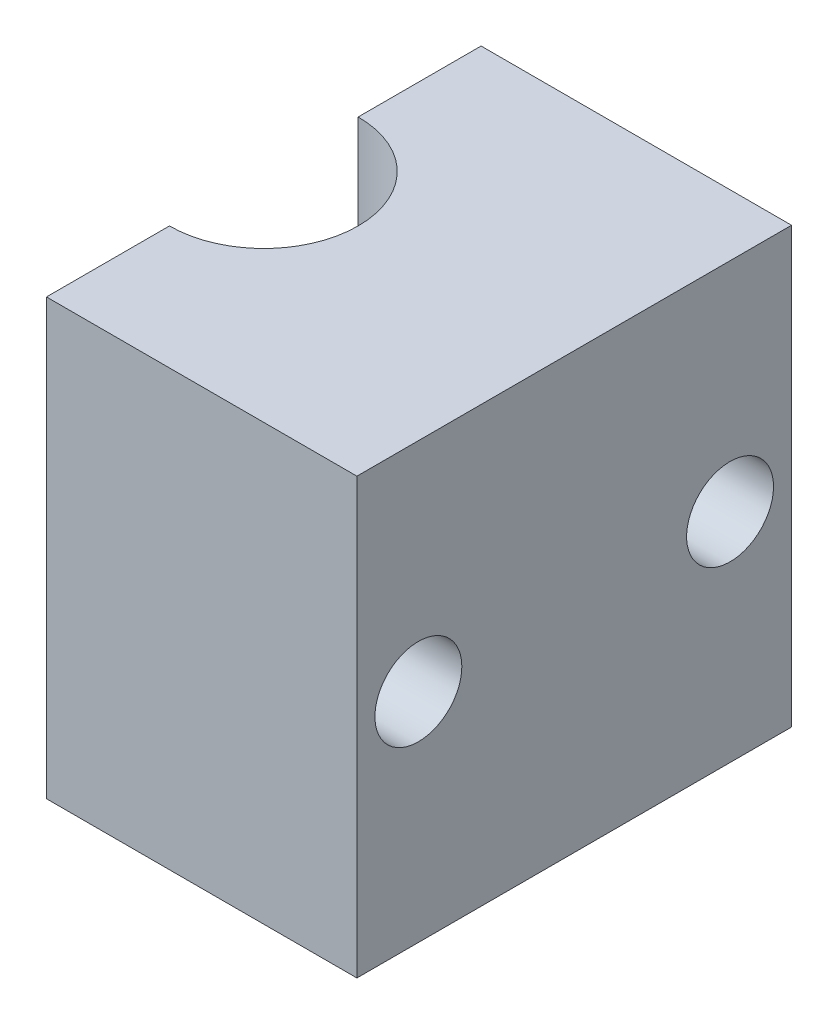
from build123d import *

# Parameters (mm, degrees)
BOSS_EXTRUDE1_DEPTH = 35
SKETCH3_R           = 6.3
CUT_EXTRUDE1_DEPTH  = 20
SKETCH4_R           = 1.5
CUT_EXTRUDE2_DEPTH  = 47.435439128
SKETCH5_R           = 3.5
CUT_EXTRUDE3_DEPTH  = 5


with BuildPart() as part:
    # Sketch1 → Boss-Extrude1 (new body)
    with BuildSketch(Plane(origin=(0, 0, 0), x_dir=(1, 0, 0), z_dir=(0, 1, 0))):
        with BuildLine():
            Line((-32.48, -7.6), (-32.48, -17.5))
            Line((-32.48, -17.5), (-7.48, -17.5))
            Line((-7.48, -17.5), (-7.48, 17.5))
            Line((-7.48, 17.5), (-32.48, 17.5))
            Line((-32.48, 17.5), (-32.48, 7.6))
            ThreePointArc((-32.48, 7.6), (-24.88, 0), (-32.48, -7.6))
        make_face()
    extrude(amount=BOSS_EXTRUDE1_DEPTH)

    # Sketch3 → Cut-Extrude1 (cut)
    with BuildSketch(Plane.ZY.offset(32.48)):
        with Locations((0, 17.5)):
            Circle(SKETCH3_R)
    extrude(amount=-CUT_EXTRUDE1_DEPTH, mode=Mode.SUBTRACT)

    # Sketch4 → Cut-Extrude2 (cut, through all)
    with BuildSketch(Plane.ZY.offset(32.48)):
        with Locations((12.55, 17.5)):
            Circle(SKETCH4_R)
        with Locations((-12.55, 17.5)):
            Circle(SKETCH4_R)
    extrude(amount=-CUT_EXTRUDE2_DEPTH, mode=Mode.SUBTRACT)

    # Sketch5 → Cut-Extrude3 (cut)
    with BuildSketch(Plane(origin=(-7.48, 0, 0), x_dir=(0, 0, -1), z_dir=(1, 0, 0))):
        with Locations((-12.55, 17.5)):
            Circle(SKETCH5_R)
        with Locations((12.55, 17.5)):
            Circle(SKETCH5_R)
    extrude(amount=-CUT_EXTRUDE3_DEPTH, mode=Mode.SUBTRACT)


solid = part.part
